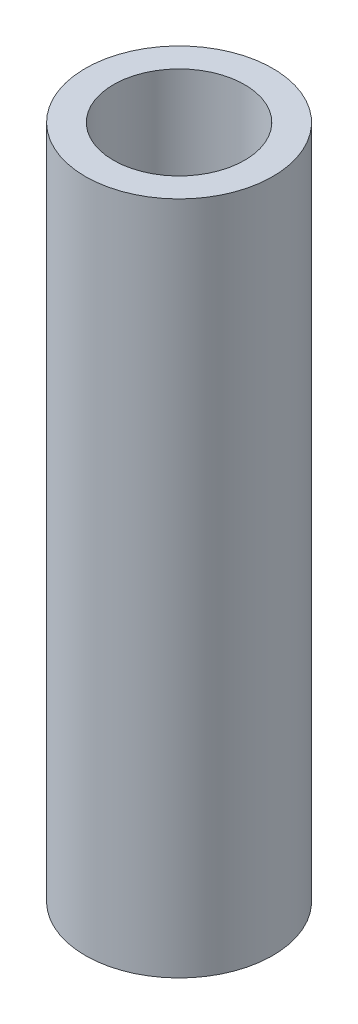
from build123d import *

# Parameters (mm, degrees)
SKETCH_1_R      = 10
SKETCH_1_R_2    = 7
EXTRUDE_1_DEPTH = 72


with BuildPart() as part:
    # 草图1 → 凸台-拉伸1 (new body)
    with BuildSketch(Plane(origin=(0, 0, 0), x_dir=(1, 0, 0), z_dir=(0, 1, 0))):
        with Locations(Location((0, 0, 0), (0, 0, 270))):
            Circle(SKETCH_1_R)
        with Locations(Location((0, 0, 0), (0, 0, 270))):
            Circle(SKETCH_1_R_2, mode=Mode.SUBTRACT)
    extrude(amount=EXTRUDE_1_DEPTH)


solid = part.part
